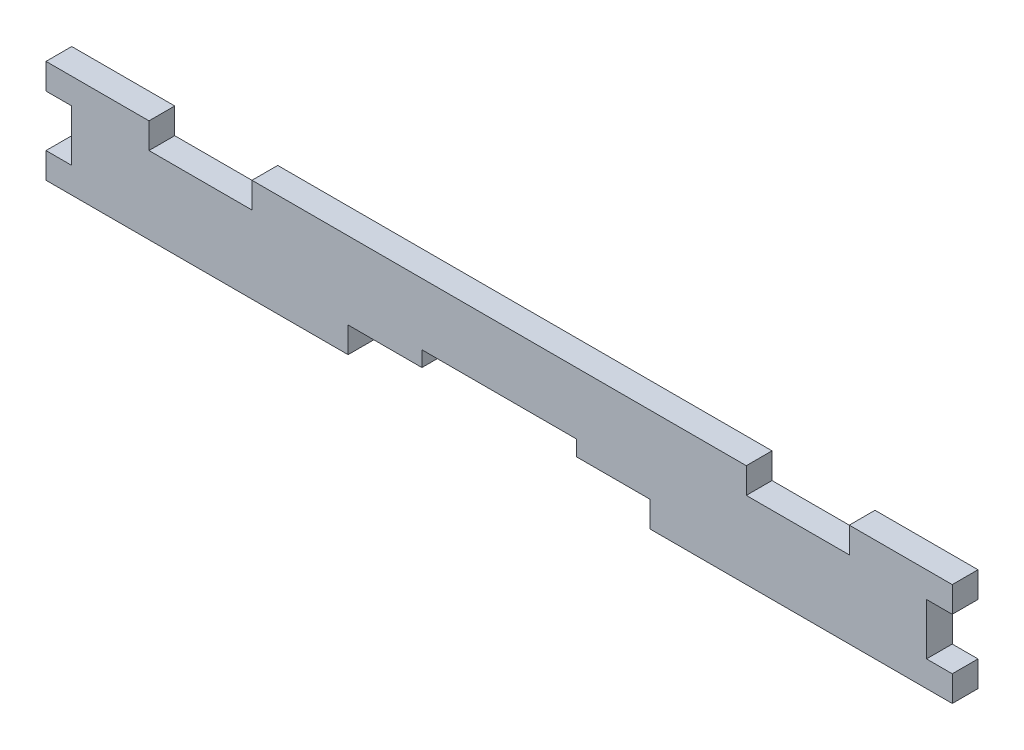
from build123d import *

# Parameters (mm, degrees)
SALIENTE_EXTRUIR1_DEPTH = 5
CROQUIS2_W              = 30
CROQUIS2_H              = 3
CORTAR_EXTRUIR1_DEPTH   = 10


with BuildPart() as part:
    # Croquis1 → Saliente-Extruir1 (new body)
    with BuildSketch(Plane.XY):
        Polygon((117.333333333, 0), (176, 0), (176, 5), (171, 5), (171, 15), (176, 15), (176, 20), (156, 20), (156, 15), (136, 15), (136, 20), (40, 20), (40, 15), (20, 15), (20, 20), (0, 20), (0, 15), (5, 15), (5, 5), (0, 5), (0, 0), (58.666666667, 0), (58.666666667, 5), (117.333333333, 5), align=None)
    extrude(amount=SALIENTE_EXTRUIR1_DEPTH)

    # Croquis2 → Cortar-Extruir1 (cut)
    with BuildSketch(Plane.XY.offset(5)):
        with Locations((88.001666667, 6.5)):
            Rectangle(CROQUIS2_W, CROQUIS2_H)
    extrude(amount=-CORTAR_EXTRUIR1_DEPTH, mode=Mode.SUBTRACT)


solid = part.part
